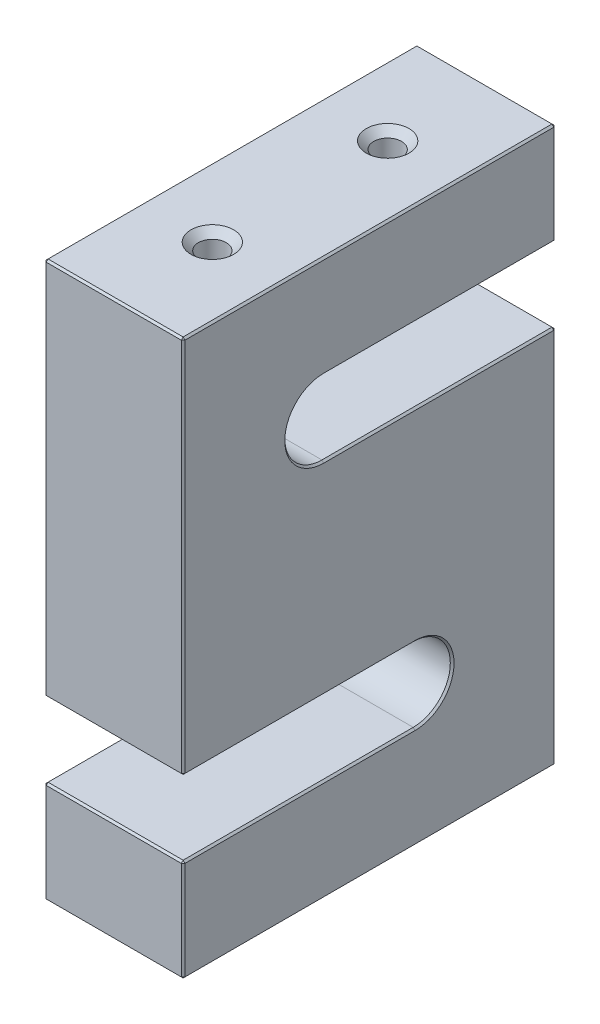
from build123d import *

# Parameters (mm, degrees)
BOSS_EXTRUDE1_DEPTH = 19
SKETCH2_R           = 1.905
CUT_EXTRUDE1_DEPTH  = 10.16
CHAMFER1_SIZE       = 1.016
CHAMFER2_SIZE       = 0.254
CHAMFER3_SIZE       = 1.016


with BuildPart() as part:
    # Sketch1 → Boss-Extrude1 (new body)
    with BuildSketch(Plane(origin=(0, 0, 0), x_dir=(0, 0, -1), z_dir=(1, 0, 0))):
        with BuildLine():
            Line((6.25, -13.87), (-25.5, -13.87))
            Line((-25.5, -13.87), (-25.5, 38))
            Line((-25.5, 38), (25.5, 38))
            Line((25.5, 38), (25.5, 24.08))
            Line((25.5, 24.08), (-6.25, 24.08))
            ThreePointArc((-6.25, 24.08), (-11.33, 19), (-6.25, 13.92))
            Line((-6.25, 13.92), (25.5, 13.92))
            Line((25.5, 13.92), (25.5, -38))
            Line((25.5, -38), (-25.5, -38))
            Line((-25.5, -38), (-25.5, -24.03))
            Line((-25.5, -24.03), (6.25, -24.03))
            ThreePointArc((6.25, -24.03), (11.33, -18.95), (6.25, -13.87))
        make_face()
    extrude(amount=BOSS_EXTRUDE1_DEPTH)

    # Sketch2 → Cut-Extrude1 (cut)
    with BuildSketch(Plane.XZ.offset(38)):
        with Locations(Location((9.5, 12, 0), (0, 0, 270))):
            Circle(SKETCH2_R)
        with Locations(Location((9.5, -12, 0), (0, 0, 90))):
            Circle(SKETCH2_R)
    cut_extrude1 = extrude(amount=-CUT_EXTRUDE1_DEPTH, mode=Mode.SUBTRACT)

    # Chamfer1
    chamfer1_edges = [part.edges().sort_by_distance(p)[0] for p in [
        (9.5, -38, 13.905),
        (9.5, -38, -13.905),
    ]]
    chamfer(chamfer1_edges, length=CHAMFER1_SIZE)

    # Chamfer2
    chamfer2_edges = [part.edges().sort_by_distance(p)[0] for p in [
        (19, -18.95, -11.33),
        (0, 12.065, 25.5),
        (0, 38, 0),
        (0, 31.04, -25.5),
        (0, 24.08, -9.625),
        (19, -24.03, 9.625),
        (0, 19, 11.33),
        (0, 13.92, -9.625),
        (0, -12.04, -25.5),
        (0, -38, 0),
        (0, -31.015, 25.5),
        (0, -24.03, 9.625),
        (0, -18.95, -11.33),
        (0, -13.87, 9.625),
        (19, -31.015, 25.5),
        (9.5, -13.87, 25.5),
        (9.5, 38, 25.5),
        (9.5, 38, -25.5),
        (9.5, 24.08, -25.5),
        (9.5, 13.92, -25.5),
        (9.5, -38, -25.5),
        (9.5, -38, 25.5),
        (9.5, -24.03, 25.5),
        (19, -38, 0),
        (19, -12.04, -25.5),
        (19, 13.92, -9.625),
        (19, 19, 11.33),
        (19, 24.08, -9.625),
        (19, 31.04, -25.5),
        (19, 38, 0),
        (19, -13.87, 9.625),
        (19, 12.065, 25.5),
    ]]
    chamfer(chamfer2_edges, length=CHAMFER2_SIZE)

    # Mirror3: Cut-Extrude1 across plane
    add(cut_extrude1.mirror(Plane.ZX), mode=Mode.SUBTRACT)

    # Chamfer3
    chamfer3_edges = [part.edges().sort_by_distance(p)[0] for p in [
        (9.5, 38, 13.905),
        (9.5, 38, -13.905),
    ]]
    chamfer(chamfer3_edges, length=CHAMFER3_SIZE)


solid = part.part
